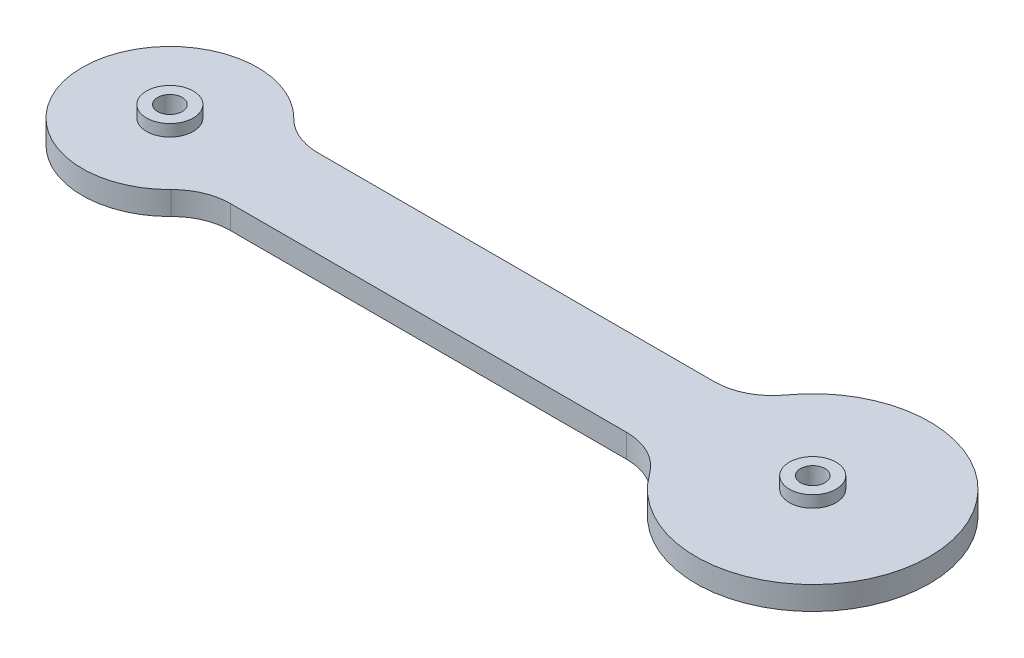
from build123d import *

# Parameters (mm, degrees)
SKETCH1_R           = 2.1
BOSS_EXTRUDE1_DEPTH = 4
FILLET1_R           = 10
SKETCH2_R           = 4
SKETCH2_R_2         = 2.1
BOSS_EXTRUDE2_DEPTH = 2


with BuildPart() as part:
    # Sketch1 → Boss-Extrude1 (new body)
    with BuildSketch(Plane(origin=(0, 0, 0), x_dir=(1, 0, 0), z_dir=(0, 1, 0))):
        with BuildLine():
            Line((-42.009618943, 7.5), (36.459503782, 7.5))
            ThreePointArc((36.459503782, 7.5), (75, 0), (36.459503782, -7.5))
            Line((36.459503782, -7.5), (-42.009618943, -7.5))
            ThreePointArc((-42.009618943, -7.5), (-70, 0), (-42.009618943, 7.5))
        make_face()
        with Locations(Location((-55, 0, 0), (0, 0, 270))):
            Circle(SKETCH1_R, mode=Mode.SUBTRACT)
        with Locations(Location((55, 0, 0), (0, 0, 270))):
            Circle(SKETCH1_R, mode=Mode.SUBTRACT)
    extrude(amount=BOSS_EXTRUDE1_DEPTH)

    # Fillet1
    fillet1_edges = [part.edges().sort_by_distance(p)[0] for p in [
        (36.459503782, 2, 7.5),
        (-42.009618943, 2, 7.5),
        (-42.009618943, 2, -7.5),
        (36.459503782, 2, -7.5),
    ]]
    fillet(fillet1_edges, radius=FILLET1_R)

    # Sketch2 → Boss-Extrude2 (add)
    # profile 1 of 2: a face of its own
    with BuildSketch(Plane(origin=(0, 4, 0), x_dir=(1, 0, 0), z_dir=(0, 1, 0))):
        with Locations(Location((55, 0, 0), (0, 0, 270))):
            Circle(SKETCH2_R)
        with Locations(Location((55, 0, 0), (0, 0, 270))):
            Circle(SKETCH2_R_2, mode=Mode.SUBTRACT)
    # profile 2 of 2: a face of its own
    with BuildSketch(Plane(origin=(0, 4, 0), x_dir=(1, 0, 0), z_dir=(0, 1, 0))):
        with Locations(Location((-55, 0, 0), (0, 0, 270))):
            Circle(SKETCH2_R)
        with Locations(Location((-55, 0, 0), (0, 0, 270))):
            Circle(SKETCH2_R_2, mode=Mode.SUBTRACT)
    extrude(amount=BOSS_EXTRUDE2_DEPTH)


solid = part.part
